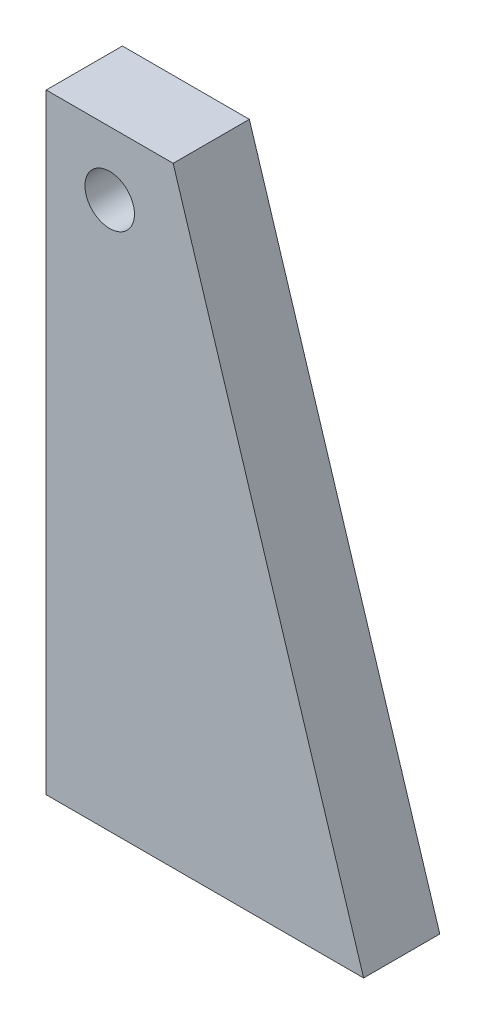
from build123d import *

# Parameters (mm, degrees)
SKETCH_1_R      = 1.95
EXTRUDE_1_DEPTH = 6


with BuildPart() as part:
    # 草图1 → 凸台-拉伸1 (new body)
    with BuildSketch(Plane.XY):
        Polygon((0, 0), (-5, 0), (-5, 48.07), (5, 48.07), (20, 0), align=None)
        with Locations((0, 43.07)):
            Circle(SKETCH_1_R, mode=Mode.SUBTRACT)
    extrude(amount=EXTRUDE_1_DEPTH)


solid = part.part
